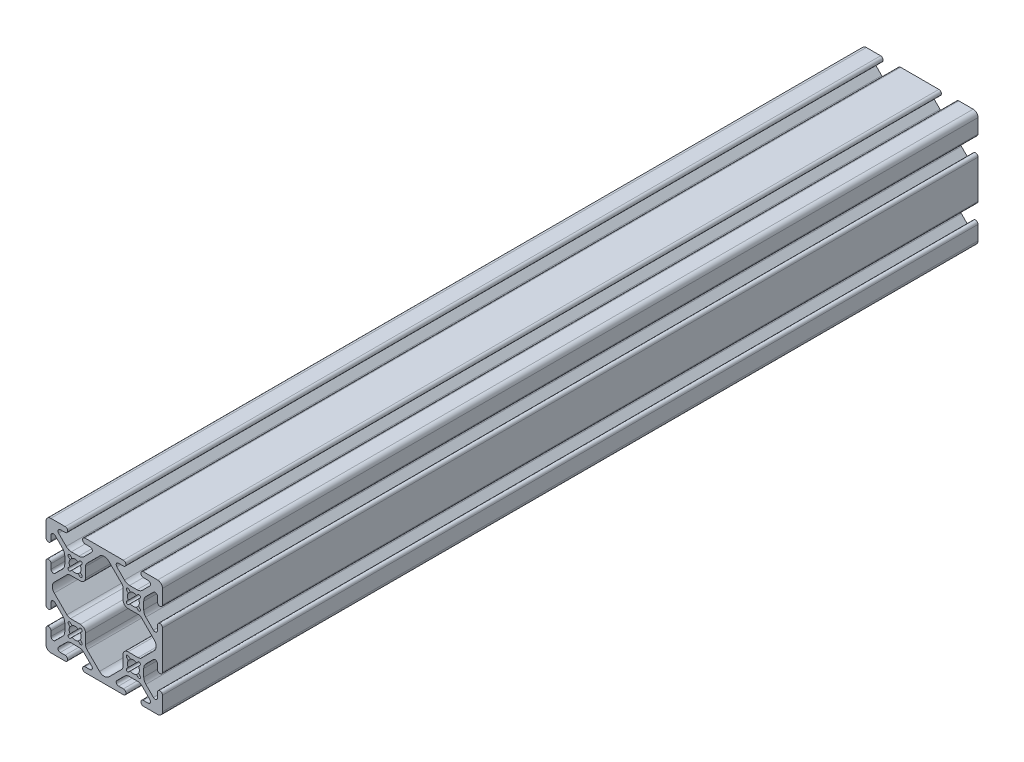
from build123d import *

# Parameters (mm, degrees)
EXTRUDE1_DEPTH = 355.6


with BuildPart() as part:
    # Sketch1 → Extrude1 (new body)
    with BuildSketch(Plane.XY):
        with BuildLine():
            Line((25.4, 17.0561), (25.4, 23.2918))
            ThreePointArc((25.4, 23.2918), (24.782522516, 24.782522516), (23.2918, 25.4))
            Line((23.2918, 25.4), (17.0561, 25.4))
            ThreePointArc((17.0561, 25.4), (15.9512, 24.2951), (17.0561, 23.1902))
            Line((17.0561, 23.1902), (19.174899798, 23.1902))
            ThreePointArc((19.174899798, 23.1902), (20.113561403, 22.563006367), (19.893320288, 21.45577951))
            Line((19.893320288, 21.45577951), (16.58464389, 18.147103113))
            ThreePointArc((16.58464389, 18.147103113), (15.554599758, 17.458849627), (14.33957986, 17.217167143))
            Line((14.33957986, 17.217167143), (11.06042014, 17.217167143))
            ThreePointArc((11.06042014, 17.217167143), (9.845400242, 17.458849627), (8.81535611, 18.147103113))
            Line((8.81535611, 18.147103113), (5.506679712, 21.45577951))
            ThreePointArc((5.506679712, 21.45577951), (5.286438597, 22.563006367), (6.225100202, 23.1902))
            Line((6.225100202, 23.1902), (8.3439, 23.1902))
            ThreePointArc((8.3439, 23.1902), (9.4488, 24.2951), (8.3439, 25.4))
            Line((8.3439, 25.4), (-8.3439, 25.4))
            ThreePointArc((-8.3439, 25.4), (-9.4488, 24.2951), (-8.3439, 23.1902))
            Line((-8.3439, 23.1902), (-6.225100202, 23.1902))
            ThreePointArc((-6.225100202, 23.1902), (-5.286438597, 22.563006367), (-5.506679712, 21.45577951))
            Line((-5.506679712, 21.45577951), (-8.81535611, 18.147103113))
            ThreePointArc((-8.81535611, 18.147103113), (-9.845400242, 17.458849627), (-11.06042014, 17.217167143))
            Line((-11.06042014, 17.217167143), (-14.33957986, 17.217167143))
            ThreePointArc((-14.33957986, 17.217167143), (-15.554599758, 17.458849627), (-16.58464389, 18.147103113))
            Line((-16.58464389, 18.147103113), (-19.893320288, 21.45577951))
            ThreePointArc((-19.893320288, 21.45577951), (-20.113561403, 22.563006367), (-19.174899798, 23.1902))
            Line((-19.174899798, 23.1902), (-17.0561, 23.1902))
            ThreePointArc((-17.0561, 23.1902), (-15.9512, 24.2951), (-17.0561, 25.4))
            Line((-17.0561, 25.4), (-23.2918, 25.4))
            ThreePointArc((-23.2918, 25.4), (-24.782522516, 24.782522516), (-25.4, 23.2918))
            Line((-25.4, 23.2918), (-25.4, 17.0561))
            ThreePointArc((-25.4, 17.0561), (-24.2951, 15.9512), (-23.1902, 17.0561))
            Line((-23.1902, 17.0561), (-23.1902, 19.174899798))
            ThreePointArc((-23.1902, 19.174899798), (-22.563006367, 20.113561403), (-21.45577951, 19.893320288))
            Line((-21.45577951, 19.893320288), (-18.147103113, 16.58464389))
            ThreePointArc((-18.147103113, 16.58464389), (-17.458849627, 15.554599758), (-17.217167143, 14.33957986))
            Line((-17.217167143, 14.33957986), (-17.217167143, 11.06042014))
            ThreePointArc((-17.217167143, 11.06042014), (-17.458849627, 9.845400242), (-18.147103113, 8.81535611))
            Line((-18.147103113, 8.81535611), (-21.45577951, 5.506679712))
            ThreePointArc((-21.45577951, 5.506679712), (-22.563006367, 5.286438597), (-23.1902, 6.225100202))
            Line((-23.1902, 6.225100202), (-23.1902, 8.3439))
            ThreePointArc((-23.1902, 8.3439), (-24.2951, 9.4488), (-25.4, 8.3439))
            Line((-25.4, 8.3439), (-25.4, -8.3439))
            ThreePointArc((-25.4, -8.3439), (-24.2951, -9.4488), (-23.1902, -8.3439))
            Line((-23.1902, -8.3439), (-23.1902, -6.225100202))
            ThreePointArc((-23.1902, -6.225100202), (-22.563006367, -5.286438597), (-21.45577951, -5.506679712))
            Line((-21.45577951, -5.506679712), (-18.147103113, -8.81535611))
            ThreePointArc((-18.147103113, -8.81535611), (-17.458849627, -9.845400242), (-17.217167143, -11.06042014))
            Line((-17.217167143, -11.06042014), (-17.217167143, -14.33957986))
            ThreePointArc((-17.217167143, -14.33957986), (-17.458849627, -15.554599758), (-18.147103113, -16.58464389))
            Line((-18.147103113, -16.58464389), (-21.45577951, -19.893320288))
            ThreePointArc((-21.45577951, -19.893320288), (-22.563006367, -20.113561403), (-23.1902, -19.174899798))
            Line((-23.1902, -19.174899798), (-23.1902, -17.0561))
            ThreePointArc((-23.1902, -17.0561), (-24.2951, -15.9512), (-25.4, -17.0561))
            Line((-25.4, -17.0561), (-25.4, -23.2918))
            ThreePointArc((-25.4, -23.2918), (-24.782522516, -24.782522516), (-23.2918, -25.4))
            Line((-23.2918, -25.4), (-17.0561, -25.4))
            ThreePointArc((-17.0561, -25.4), (-15.9512, -24.2951), (-17.0561, -23.1902))
            Line((-17.0561, -23.1902), (-19.174899798, -23.1902))
            ThreePointArc((-19.174899798, -23.1902), (-20.113561403, -22.563006367), (-19.893320288, -21.45577951))
            Line((-19.893320288, -21.45577951), (-16.58464389, -18.147103113))
            ThreePointArc((-16.58464389, -18.147103113), (-15.554599758, -17.458849627), (-14.33957986, -17.217167143))
            Line((-14.33957986, -17.217167143), (-11.06042014, -17.217167143))
            ThreePointArc((-11.06042014, -17.217167143), (-9.845400242, -17.458849627), (-8.81535611, -18.147103113))
            Line((-8.81535611, -18.147103113), (-5.506679712, -21.45577951))
            ThreePointArc((-5.506679712, -21.45577951), (-5.286438597, -22.563006367), (-6.225100202, -23.1902))
            Line((-6.225100202, -23.1902), (-8.3439, -23.1902))
            ThreePointArc((-8.3439, -23.1902), (-9.4488, -24.2951), (-8.3439, -25.4))
            Line((-8.3439, -25.4), (8.3439, -25.4))
            ThreePointArc((8.3439, -25.4), (9.4488, -24.2951), (8.3439, -23.1902))
            Line((8.3439, -23.1902), (6.225100202, -23.1902))
            ThreePointArc((6.225100202, -23.1902), (5.286438597, -22.563006367), (5.506679712, -21.45577951))
            Line((5.506679712, -21.45577951), (8.81535611, -18.147103113))
            ThreePointArc((8.81535611, -18.147103113), (9.845400242, -17.458849627), (11.06042014, -17.217167143))
            Line((11.06042014, -17.217167143), (14.33957986, -17.217167143))
            ThreePointArc((14.33957986, -17.217167143), (15.554599758, -17.458849627), (16.58464389, -18.147103113))
            Line((16.58464389, -18.147103113), (19.893320288, -21.45577951))
            ThreePointArc((19.893320288, -21.45577951), (20.113561403, -22.563006367), (19.174899798, -23.1902))
            Line((19.174899798, -23.1902), (17.0561, -23.1902))
            ThreePointArc((17.0561, -23.1902), (15.9512, -24.2951), (17.0561, -25.4))
            Line((17.0561, -25.4), (23.2918, -25.4))
            ThreePointArc((23.2918, -25.4), (24.782522516, -24.782522516), (25.4, -23.2918))
            Line((25.4, -23.2918), (25.4, -17.0561))
            ThreePointArc((25.4, -17.0561), (24.2951, -15.9512), (23.1902, -17.0561))
            Line((23.1902, -17.0561), (23.1902, -19.174899798))
            ThreePointArc((23.1902, -19.174899798), (22.563006367, -20.113561403), (21.45577951, -19.893320288))
            Line((21.45577951, -19.893320288), (18.147103113, -16.58464389))
            ThreePointArc((18.147103113, -16.58464389), (17.458849627, -15.554599758), (17.217167143, -14.33957986))
            Line((17.217167143, -14.33957986), (17.217167143, -11.06042014))
            ThreePointArc((17.217167143, -11.06042014), (17.458849627, -9.845400242), (18.147103113, -8.81535611))
            Line((18.147103113, -8.81535611), (21.45577951, -5.506679712))
            ThreePointArc((21.45577951, -5.506679712), (22.563006367, -5.286438597), (23.1902, -6.225100202))
            Line((23.1902, -6.225100202), (23.1902, -8.3439))
            ThreePointArc((23.1902, -8.3439), (24.2951, -9.4488), (25.4, -8.3439))
            Line((25.4, -8.3439), (25.4, 8.3439))
            ThreePointArc((25.4, 8.3439), (24.2951, 9.4488), (23.1902, 8.3439))
            Line((23.1902, 8.3439), (23.1902, 6.225100202))
            ThreePointArc((23.1902, 6.225100202), (22.563006367, 5.286438597), (21.45577951, 5.506679712))
            Line((21.45577951, 5.506679712), (18.147103113, 8.81535611))
            ThreePointArc((18.147103113, 8.81535611), (17.458849627, 9.845400242), (17.217167143, 11.06042014))
            Line((17.217167143, 11.06042014), (17.217167143, 14.33957986))
            ThreePointArc((17.217167143, 14.33957986), (17.458849627, 15.554599758), (18.147103113, 16.58464389))
            Line((18.147103113, 16.58464389), (21.45577951, 19.893320288))
            ThreePointArc((21.45577951, 19.893320288), (22.563006367, 20.113561403), (23.1902, 19.174899798))
            Line((23.1902, 19.174899798), (23.1902, 17.0561))
            ThreePointArc((23.1902, 17.0561), (24.2951, 15.9512), (25.4, 17.0561))
        make_face()
        with BuildLine():
            Line((-14.669151357, 15.560474191), (-14.040533428, 14.931856263))
            ThreePointArc((-14.040533428, 14.931856263), (-12.7, 15.3035), (-11.359466572, 14.931856263))
            Line((-11.359466572, 14.931856263), (-10.730848643, 15.560474191))
            ThreePointArc((-10.730848643, 15.560474191), (-9.781416761, 15.618583239), (-9.839525809, 14.669151357))
            Line((-9.839525809, 14.669151357), (-10.468143737, 14.040533428))
            ThreePointArc((-10.468143737, 14.040533428), (-10.0965, 12.7), (-10.468143737, 11.359466572))
            Line((-10.468143737, 11.359466572), (-9.839525809, 10.730848643))
            ThreePointArc((-9.839525809, 10.730848643), (-9.781416761, 9.781416761), (-10.730848643, 9.839525809))
            Line((-10.730848643, 9.839525809), (-11.359466572, 10.468143737))
            ThreePointArc((-11.359466572, 10.468143737), (-12.7, 10.0965), (-14.040533428, 10.468143737))
            Line((-14.040533428, 10.468143737), (-14.669151357, 9.839525809))
            ThreePointArc((-14.669151357, 9.839525809), (-15.618583239, 9.781416761), (-15.560474191, 10.730848643))
            Line((-15.560474191, 10.730848643), (-14.931856263, 11.359466572))
            ThreePointArc((-14.931856263, 11.359466572), (-15.3035, 12.7), (-14.931856263, 14.040533428))
            Line((-14.931856263, 14.040533428), (-15.560474191, 14.669151357))
            ThreePointArc((-15.560474191, 14.669151357), (-15.618583239, 15.618583239), (-14.669151357, 15.560474191))
        make_face(mode=Mode.SUBTRACT)
        with BuildLine():
            Line((11.359466572, 10.468143737), (10.730848643, 9.839525809))
            ThreePointArc((10.730848643, 9.839525809), (9.781416761, 9.781416761), (9.839525809, 10.730848643))
            Line((9.839525809, 10.730848643), (10.468143737, 11.359466572))
            ThreePointArc((10.468143737, 11.359466572), (10.0965, 12.7), (10.468143737, 14.040533428))
            Line((10.468143737, 14.040533428), (9.839525809, 14.669151357))
            ThreePointArc((9.839525809, 14.669151357), (9.781416761, 15.618583239), (10.730848643, 15.560474191))
            Line((10.730848643, 15.560474191), (11.359466572, 14.931856263))
            ThreePointArc((11.359466572, 14.931856263), (12.7, 15.3035), (14.040533428, 14.931856263))
            Line((14.040533428, 14.931856263), (14.669151357, 15.560474191))
            ThreePointArc((14.669151357, 15.560474191), (15.618583239, 15.618583239), (15.560474191, 14.669151357))
            Line((15.560474191, 14.669151357), (14.931856263, 14.040533428))
            ThreePointArc((14.931856263, 14.040533428), (15.3035, 12.7), (14.931856263, 11.359466572))
            Line((14.931856263, 11.359466572), (15.560474191, 10.730848643))
            ThreePointArc((15.560474191, 10.730848643), (15.618583239, 9.781416761), (14.669151357, 9.839525809))
            Line((14.669151357, 9.839525809), (14.040533428, 10.468143737))
            ThreePointArc((14.040533428, 10.468143737), (12.7, 10.0965), (11.359466572, 10.468143737))
        make_face(mode=Mode.SUBTRACT)
        with BuildLine():
            Line((-14.669151357, -9.839525809), (-14.040533428, -10.468143737))
            ThreePointArc((-14.040533428, -10.468143737), (-12.7, -10.0965), (-11.359466572, -10.468143737))
            Line((-11.359466572, -10.468143737), (-10.730848643, -9.839525809))
            ThreePointArc((-10.730848643, -9.839525809), (-9.781416761, -9.781416761), (-9.839525809, -10.730848643))
            Line((-9.839525809, -10.730848643), (-10.468143737, -11.359466572))
            ThreePointArc((-10.468143737, -11.359466572), (-10.0965, -12.7), (-10.468143737, -14.040533428))
            Line((-10.468143737, -14.040533428), (-9.839525809, -14.669151357))
            ThreePointArc((-9.839525809, -14.669151357), (-9.781416761, -15.618583239), (-10.730848643, -15.560474191))
            Line((-10.730848643, -15.560474191), (-11.359466572, -14.931856263))
            ThreePointArc((-11.359466572, -14.931856263), (-12.7, -15.3035), (-14.040533428, -14.931856263))
            Line((-14.040533428, -14.931856263), (-14.669151357, -15.560474191))
            ThreePointArc((-14.669151357, -15.560474191), (-15.618583239, -15.618583239), (-15.560474191, -14.669151357))
            Line((-15.560474191, -14.669151357), (-14.931856263, -14.040533428))
            ThreePointArc((-14.931856263, -14.040533428), (-15.3035, -12.7), (-14.931856263, -11.359466572))
            Line((-14.931856263, -11.359466572), (-15.560474191, -10.730848643))
            ThreePointArc((-15.560474191, -10.730848643), (-15.618583239, -9.781416761), (-14.669151357, -9.839525809))
        make_face(mode=Mode.SUBTRACT)
        with BuildLine():
            Line((10.730848643, -9.839525809), (11.359466572, -10.468143737))
            ThreePointArc((11.359466572, -10.468143737), (12.7, -10.0965), (14.040533428, -10.468143737))
            Line((14.040533428, -10.468143737), (14.669151357, -9.839525809))
            ThreePointArc((14.669151357, -9.839525809), (15.618583239, -9.781416761), (15.560474191, -10.730848643))
            Line((15.560474191, -10.730848643), (14.931856263, -11.359466572))
            ThreePointArc((14.931856263, -11.359466572), (15.3035, -12.7), (14.931856263, -14.040533428))
            Line((14.931856263, -14.040533428), (15.560474191, -14.669151357))
            ThreePointArc((15.560474191, -14.669151357), (15.618583239, -15.618583239), (14.669151357, -15.560474191))
            Line((14.669151357, -15.560474191), (14.040533428, -14.931856263))
            ThreePointArc((14.040533428, -14.931856263), (12.7, -15.3035), (11.359466572, -14.931856263))
            Line((11.359466572, -14.931856263), (10.730848643, -15.560474191))
            ThreePointArc((10.730848643, -15.560474191), (9.781416761, -15.618583239), (9.839525809, -14.669151357))
            Line((9.839525809, -14.669151357), (10.468143737, -14.040533428))
            ThreePointArc((10.468143737, -14.040533428), (10.0965, -12.7), (10.468143737, -11.359466572))
            Line((10.468143737, -11.359466572), (9.839525809, -10.730848643))
            ThreePointArc((9.839525809, -10.730848643), (9.781416761, -9.781416761), (10.730848643, -9.839525809))
        make_face(mode=Mode.SUBTRACT)
        with BuildLine():
            Line((7.535597422, -16.30173267), (2.058651438, -21.778678654))
            ThreePointArc((2.058651438, -21.778678654), (0, -22.6314), (-2.058651438, -21.778678654))
            Line((-2.058651438, -21.778678654), (-7.535597422, -16.30173267))
            ThreePointArc((-7.535597422, -16.30173267), (-8.014621848, -15.584821954), (-8.182832857, -14.739168105))
            Line((-8.182832857, -14.739168105), (-8.182832857, -10.392632857))
            ThreePointArc((-8.182832857, -10.392632857), (-8.830068292, -8.830068292), (-10.392632857, -8.182832857))
            Line((-10.392632857, -8.182832857), (-14.739168105, -8.182832857))
            ThreePointArc((-14.739168105, -8.182832857), (-15.584821954, -8.014621848), (-16.30173267, -7.535597422))
            Line((-16.30173267, -7.535597422), (-21.778678654, -2.058651438))
            ThreePointArc((-21.778678654, -2.058651438), (-22.6314, 0), (-21.778678654, 2.058651438))
            Line((-21.778678654, 2.058651438), (-16.30173267, 7.535597422))
            ThreePointArc((-16.30173267, 7.535597422), (-15.584821954, 8.014621848), (-14.739168105, 8.182832857))
            Line((-14.739168105, 8.182832857), (-10.392632857, 8.182832857))
            ThreePointArc((-10.392632857, 8.182832857), (-8.830068292, 8.830068292), (-8.182832857, 10.392632857))
            Line((-8.182832857, 10.392632857), (-8.182832857, 14.739168105))
            ThreePointArc((-8.182832857, 14.739168105), (-8.014621848, 15.584821954), (-7.535597422, 16.30173267))
            Line((-7.535597422, 16.30173267), (-2.058651438, 21.778678654))
            ThreePointArc((-2.058651438, 21.778678654), (0, 22.6314), (2.058651438, 21.778678654))
            Line((2.058651438, 21.778678654), (7.535597422, 16.30173267))
            ThreePointArc((7.535597422, 16.30173267), (8.014621848, 15.584821954), (8.182832857, 14.739168105))
            Line((8.182832857, 14.739168105), (8.182832857, 10.392632857))
            ThreePointArc((8.182832857, 10.392632857), (8.830068292, 8.830068292), (10.392632857, 8.182832857))
            Line((10.392632857, 8.182832857), (14.739168105, 8.182832857))
            ThreePointArc((14.739168105, 8.182832857), (15.584821954, 8.014621848), (16.30173267, 7.535597422))
            Line((16.30173267, 7.535597422), (21.778678654, 2.058651438))
            ThreePointArc((21.778678654, 2.058651438), (22.6314, 0), (21.778678654, -2.058651438))
            Line((21.778678654, -2.058651438), (16.30173267, -7.535597422))
            ThreePointArc((16.30173267, -7.535597422), (15.584821954, -8.014621848), (14.739168105, -8.182832857))
            Line((14.739168105, -8.182832857), (10.392632857, -8.182832857))
            ThreePointArc((10.392632857, -8.182832857), (8.830068292, -8.830068292), (8.182832857, -10.392632857))
            Line((8.182832857, -10.392632857), (8.182832857, -14.739168105))
            ThreePointArc((8.182832857, -14.739168105), (8.014621848, -15.584821954), (7.535597422, -16.30173267))
        make_face(mode=Mode.SUBTRACT)
    extrude(amount=-EXTRUDE1_DEPTH)


solid = part.part
